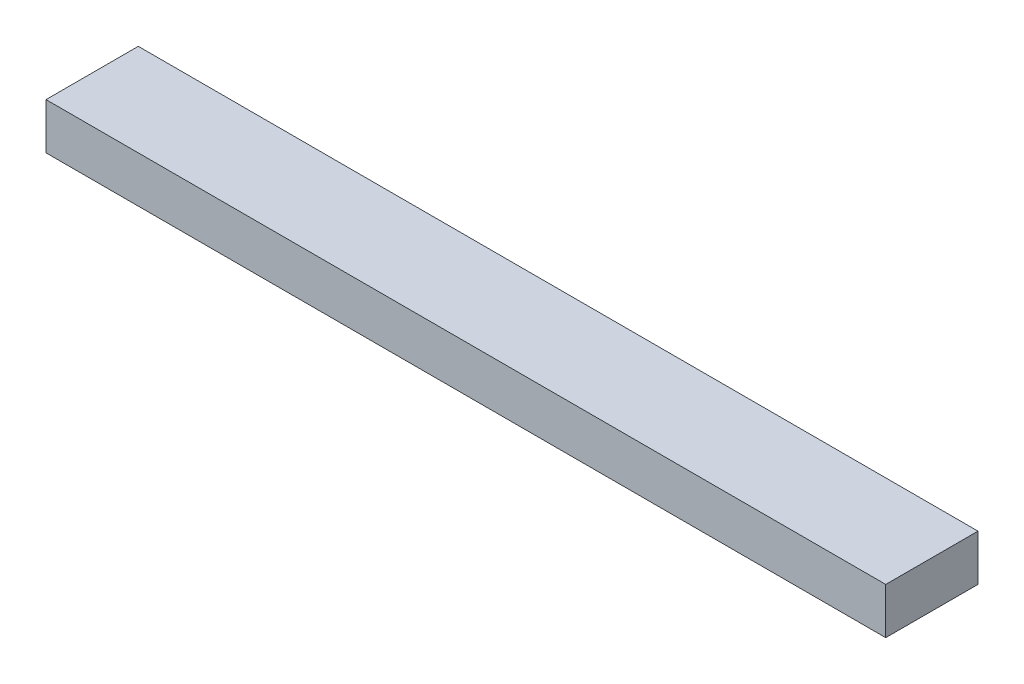
from build123d import *

# Parameters (mm, degrees)
SKETCH1_W           = 115.57
SKETCH1_H           = 12.7
BOSS_EXTRUDE1_DEPTH = 6.35


with BuildPart() as part:
    # Sketch1 → Boss-Extrude1 (new body)
    with BuildSketch(Plane(origin=(0, 0, 0), x_dir=(1, 0, 0), z_dir=(0, 1, 0))):
        Rectangle(SKETCH1_W, SKETCH1_H)
    extrude(amount=BOSS_EXTRUDE1_DEPTH)


solid = part.part
